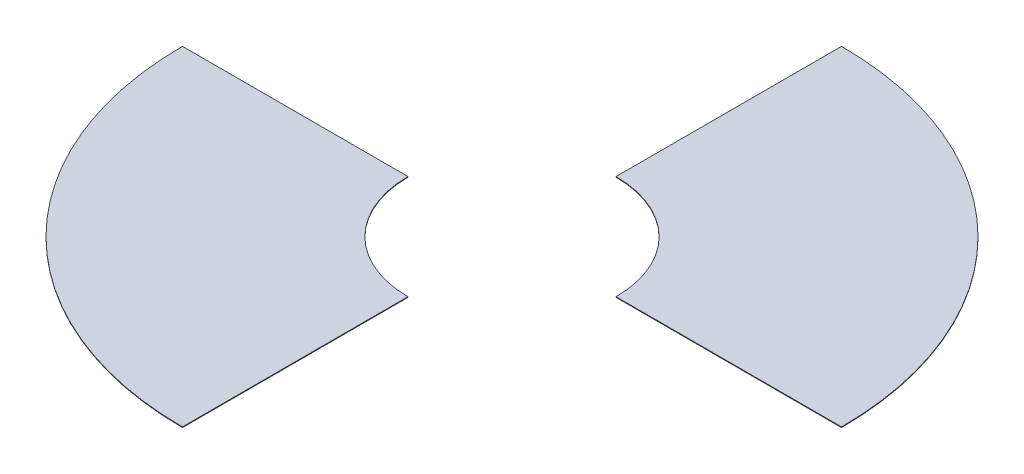
from build123d import *

# Parameters (mm, degrees)
BOSS_EXTRUDE1_DEPTH   = 0.508
BOSS_EXTRUDE1_2_DEPTH = 0.508


with BuildPart() as part:
    # Sketch1 → Boss-Extrude1 (new body)
    with BuildSketch(Plane(origin=(0, 0, 0), x_dir=(1, 0, 0), z_dir=(0, 1, 0))):
        with BuildLine():
            Line((0, 76.2), (0, 241.3))
            ThreePointArc((0, 241.3), (170.6248663, 170.6248663), (241.3, 0))
            Line((241.3, 0), (76.2, 0))
            ThreePointArc((76.2, 0), (53.881536726, 53.881536726), (0, 76.2))
        make_face()
    extrude(amount=BOSS_EXTRUDE1_DEPTH)


with BuildPart() as body_2:
    # Sketch1 → Boss-Extrude1 2 (new body)
    with BuildSketch(Plane(origin=(0, 0, 0), x_dir=(1, 0, 0), z_dir=(0, 1, 0))):
        with BuildLine():
            Line((-76.2, 0), (-241.3, 0))
            ThreePointArc((-241.3, 0), (-170.6248663, -170.6248663), (0, -241.3))
            Line((0, -241.3), (0, -76.2))
            ThreePointArc((0, -76.2), (-53.881536726, -53.881536726), (-76.2, 0))
        make_face()
    extrude(amount=BOSS_EXTRUDE1_2_DEPTH)


solid = Compound([part.part, body_2.part])
